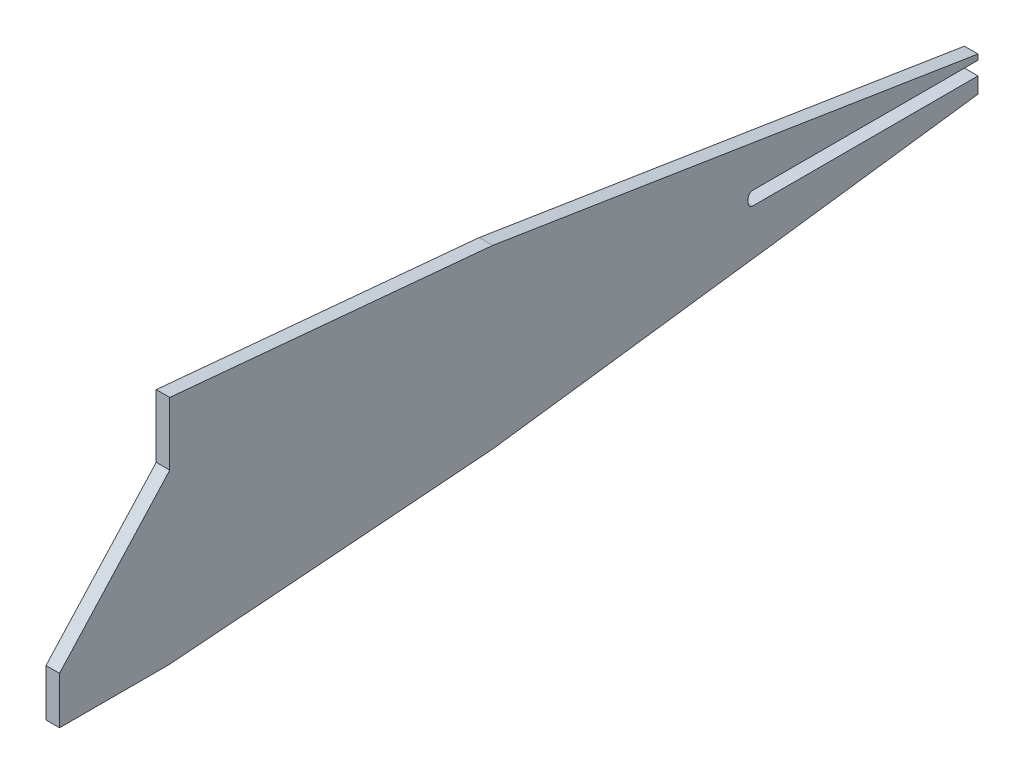
from build123d import *

# Parameters (mm, degrees)
BOSS_EXTRUDE1_DEPTH      = 4.3
BOSS_EXTRUDE1_DEPTH_BACK = 4.3
SKETCH3_W                = 152
SKETCH3_H                = 8.6
CUT_EXTRUDE1_DEPTH       = 520.595708462
FILLET1_R                = 3


with BuildPart() as part:
    # Sketch2 → Boss-Extrude1 (new, two sides: drawn at the far end of the back side and taken through both)
    with BuildSketch(Plane(origin=(0, 0, 0), x_dir=(0, 0, -1), z_dir=(1, 0, 0)).offset(-BOSS_EXTRUDE1_DEPTH_BACK)):
        Polygon((0, 67.22485033), (205.165503831, 48.288859026), (513.4, -0.530689138), (513.4, -22.650154351), (205.250409944, -63.717607751), (0, -79.537288439), (-70, -79.537288439), (-70, -49.537288439), (0, 27.22485033), align=None)
    extrude(amount=BOSS_EXTRUDE1_DEPTH + BOSS_EXTRUDE1_DEPTH_BACK)

    # Sketch3 → Cut-Extrude1 (cut, through all)
    with BuildSketch(Plane(origin=(4.3, 0, 0), x_dir=(0, 0, -1), z_dir=(1, 0, 0))):
        with Locations((443.4, -8.3)):
            Rectangle(SKETCH3_W, SKETCH3_H)
    extrude(amount=-CUT_EXTRUDE1_DEPTH, mode=Mode.SUBTRACT)

    # Fillet1
    fillet1_edges = [part.edges().sort_by_distance(p)[0] for p in [
        (0, -4, -367.4),
        (0, -12.6, -367.4),
    ]]
    fillet(fillet1_edges, radius=FILLET1_R)


solid = part.part
